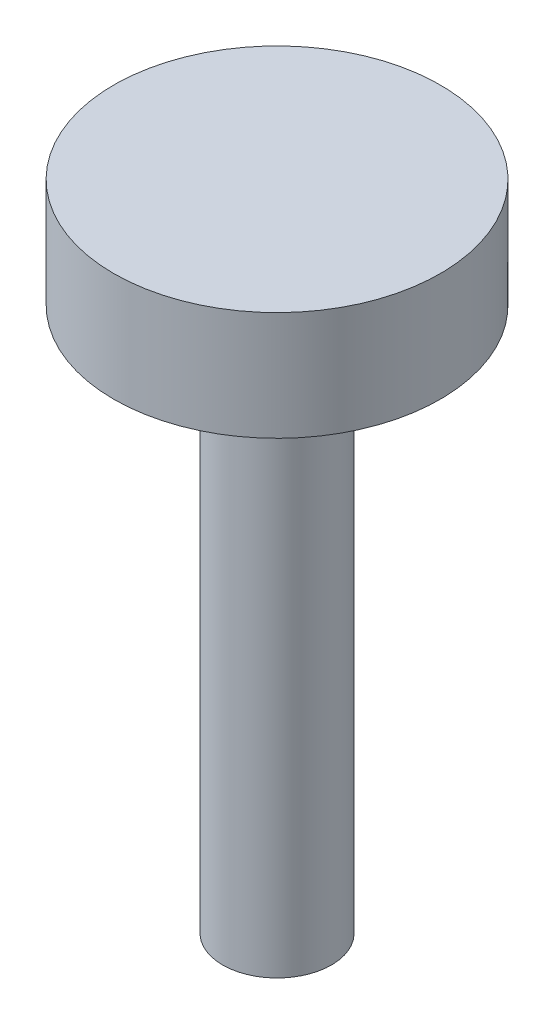
from build123d import *

# Parameters (mm, degrees)
SKETCH1_R           = 2.5
BOSS_EXTRUDE1_DEPTH = 25
SKETCH3_R           = 7.5
BOSS_EXTRUDE2_DEPTH = 5


with BuildPart() as part:
    # Sketch1 → Boss-Extrude1 (new body)
    with BuildSketch(Plane(origin=(0, 0, 0), x_dir=(1, 0, 0), z_dir=(0, 1, 0))):
        with Locations(Location((0, 0, 0), (0, 0, 270))):
            Circle(SKETCH1_R)
    extrude(amount=BOSS_EXTRUDE1_DEPTH)

    # Sketch3 → Boss-Extrude2 (add)
    with BuildSketch(Plane(origin=(0, 25, 0), x_dir=(1, 0, 0), z_dir=(0, 1, 0))):
        with Locations(Location((0, 0, 0), (0, 0, 270))):
            Circle(SKETCH3_R)
    extrude(amount=BOSS_EXTRUDE2_DEPTH)


solid = part.part
